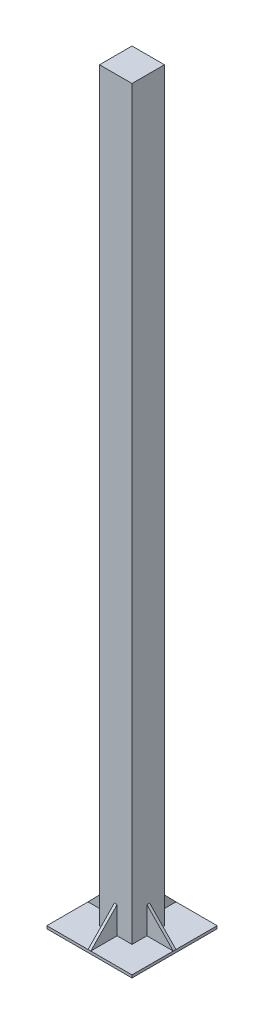
from build123d import *

# Parameters (mm, degrees)
CROQUIS1_W              = 400
CROQUIS1_H              = 400
SALIENTE_EXTRUIR1_DEPTH = 12.7
CROQUIS2_W              = 152.4
CROQUIS2_H              = 152.4
SALIENTE_EXTRUIR2_DEPTH = 3500
CROQUIS3_W              = 123.8
CROQUIS3_H              = 12.7
CROQUIS3_W_2            = 12.7
CROQUIS3_H_2            = 123.8
SALIENTE_EXTRUIR3_DEPTH = 127
CORTAR_EXTRUIR1_DEPTH   = 13
CORTAR_EXTRUIR2_DEPTH   = 13
CORTAR_EXTRUIR3_DEPTH   = 13
CORTAR_EXTRUIR4_DEPTH   = 13


with BuildPart() as part:
    # Croquis1 → Saliente-Extruir1 (new body)
    with BuildSketch(Plane(origin=(0, 0, 0), x_dir=(1, 0, 0), z_dir=(0, 1, 0))):
        Rectangle(CROQUIS1_W, CROQUIS1_H)
    extrude(amount=SALIENTE_EXTRUIR1_DEPTH)

    # Croquis2 → Saliente-Extruir2 (add)
    with BuildSketch(Plane(origin=(0, 12.7, 0), x_dir=(1, 0, 0), z_dir=(0, 1, 0))):
        Rectangle(CROQUIS2_W, CROQUIS2_H)
    extrude(amount=SALIENTE_EXTRUIR2_DEPTH)

    # Croquis3 → Saliente-Extruir3 (add)
    with BuildSketch(Plane(origin=(0, 12.7, 0), x_dir=(1, 0, 0), z_dir=(0, 1, 0))):
        with Locations((138.1, 0)):
            Rectangle(CROQUIS3_W, CROQUIS3_H)
        with Locations((-138.1, 0)):
            Rectangle(CROQUIS3_W, CROQUIS3_H)
        with Locations((0, 138.1)):
            Rectangle(CROQUIS3_W_2, CROQUIS3_H_2)
        with Locations((0, -138.1)):
            Rectangle(CROQUIS3_W_2, CROQUIS3_H_2)
    extrude(amount=SALIENTE_EXTRUIR3_DEPTH)

    # Croquis4 → Cortar-Extruir1 (cut)
    with BuildSketch(Plane(origin=(6.35, 0, 0), x_dir=(0, 0, -1), z_dir=(1, 0, 0))):
        Polygon((-200, 12.7), (-76.2, 139.7), (-200, 139.7), align=None)
    extrude(amount=-CORTAR_EXTRUIR1_DEPTH, mode=Mode.SUBTRACT)

    # Croquis5 → Cortar-Extruir2 (cut)
    with BuildSketch(Plane.XY.offset(6.35)):
        Polygon((-200, 12.7), (-76.2, 139.7), (-200, 139.7), align=None)
    extrude(amount=-CORTAR_EXTRUIR2_DEPTH, mode=Mode.SUBTRACT)

    # Croquis6 → Cortar-Extruir3 (cut)
    with BuildSketch(Plane.ZY.offset(6.35)):
        Polygon((-76.2, 139.7), (-200, 12.7), (-200, 139.7), align=None)
    extrude(amount=-CORTAR_EXTRUIR3_DEPTH, mode=Mode.SUBTRACT)

    # Croquis7 → Cortar-Extruir4 (cut)
    with BuildSketch(Plane(origin=(0, 0, -6.35), x_dir=(-1, 0, 0), z_dir=(0, 0, -1))):
        Polygon((-76.2, 139.7), (-200, 12.7), (-200, 139.7), align=None)
    extrude(amount=-CORTAR_EXTRUIR4_DEPTH, mode=Mode.SUBTRACT)


solid = part.part
